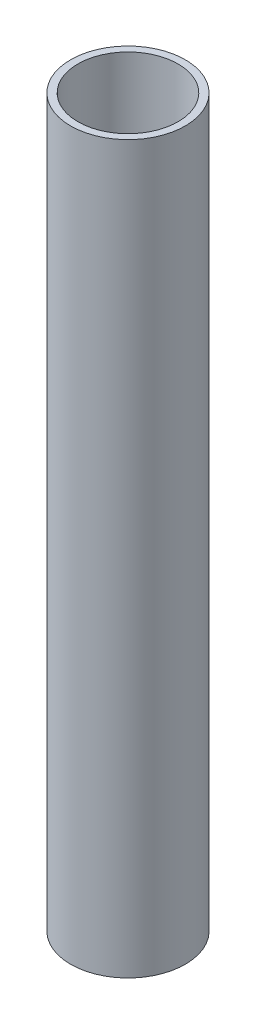
from build123d import *

# Parameters (mm, degrees)
SKETCH1_R           = 7.9
BOSS_EXTRUDE1_DEPTH = 100
SKETCH2_R           = 6.9
CUT_EXTRUDE1_DEPTH  = 99


with BuildPart() as part:
    # Sketch1 → Boss-Extrude1 (new body)
    with BuildSketch(Plane(origin=(0, 0, 0), x_dir=(1, 0, 0), z_dir=(0, 1, 0))):
        with Locations(Location((0, 0, 0), (0, 0, 270))):
            Circle(SKETCH1_R)
    extrude(amount=BOSS_EXTRUDE1_DEPTH)

    # Sketch2 → Cut-Extrude1 (cut)
    with BuildSketch(Plane(origin=(0, 100, 0), x_dir=(1, 0, 0), z_dir=(0, 1, 0))):
        with Locations(Location((0, 0, 0), (0, 0, 270))):
            Circle(SKETCH2_R)
    extrude(amount=-CUT_EXTRUDE1_DEPTH, mode=Mode.SUBTRACT)


solid = part.part
